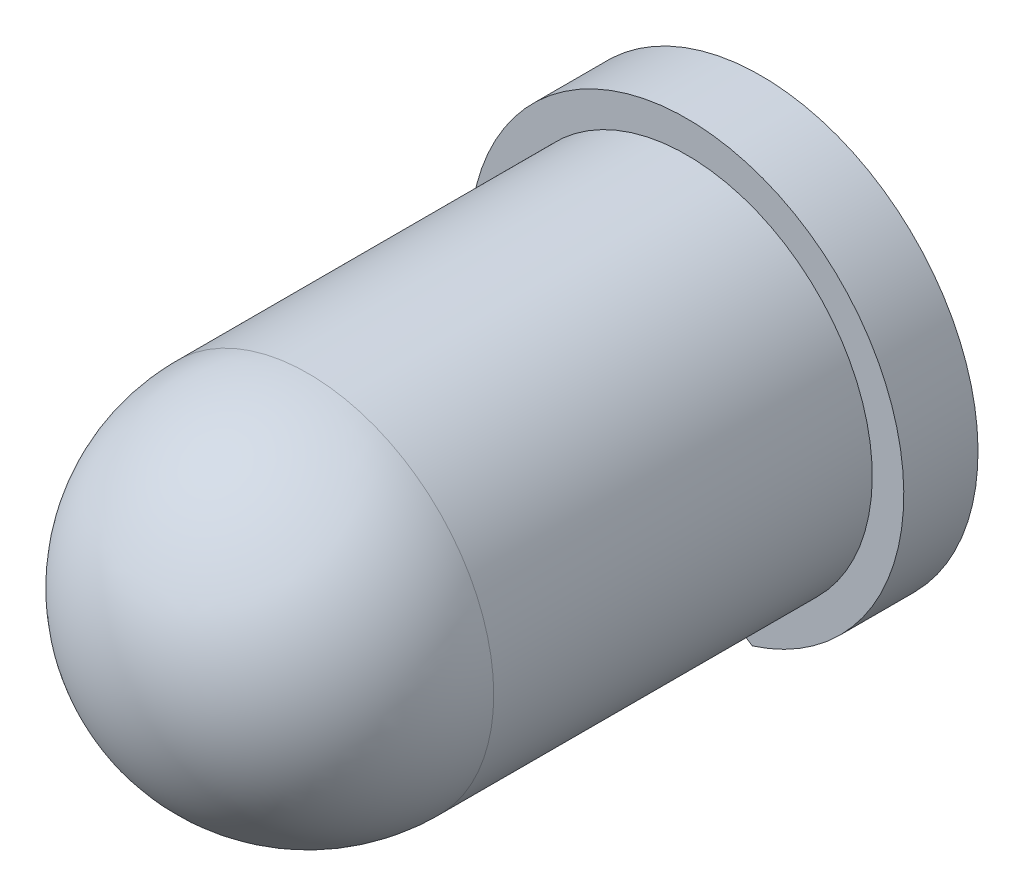
from build123d import *

# Parameters (mm, degrees)
SKETCH1_R                = 2.5
SKETCH1_R_2              = 2
BOSS_EXTRUDE1_DEPTH      = 5.1
SKETCH3_R                = 2.925
BOSS_EXTRUDE2_DEPTH      = 1
SKETCH4_R                = 2
CUT_EXTRUDE2_DEPTH       = 5.1
BOSS_EXTRUDE3_DEPTH      = 0.3
BOSS_EXTRUDE3_DEPTH_BACK = 0.3
SKETCH9_R                = 1.5
CUT_EXTRUDE3_DEPTH       = 3


with BuildPart() as part:
    # Sketch1 → Boss-Extrude1 (new body)
    with BuildSketch(Plane.XY):
        Circle(SKETCH1_R)
        Circle(SKETCH1_R_2, mode=Mode.SUBTRACT)
    extrude(amount=BOSS_EXTRUDE1_DEPTH)

    # Sketch2 → Revolve1 (revolve)
    with BuildSketch(Plane.XY.offset(5.1)):
        with BuildLine():
            Line((-2.5, 0), (-2, 0))
            ThreePointArc((-2, 0), (0, -2), (2, 0))
            Line((2, 0), (2.5, 0))
            ThreePointArc((2.5, 0), (0, -2.5), (-2.5, 0))
        make_face()
    revolve(axis=Axis((-3.079262147, 0, 5.1), (1, 0, 0)))

    # Sketch3 → Boss-Extrude2 (add)
    with BuildSketch(Plane(origin=(0, 0, 0), x_dir=(-1, 0, 0), z_dir=(0, 0, -1))):
        Circle(SKETCH3_R)
    extrude(amount=BOSS_EXTRUDE2_DEPTH)

    # Sketch4 → Cut-Extrude2 (cut)
    with BuildSketch(Plane.XY):
        Circle(SKETCH4_R)
    extrude(amount=CUT_EXTRUDE2_DEPTH, mode=Mode.SUBTRACT)

    # Sketch6 → Boss-Extrude3 (add, two sides: drawn at the far end of the back side and taken through both)
    with BuildSketch(Plane(origin=(0, 0, 0), x_dir=(0, 0, -1), z_dir=(1, 0, 0)).offset(-BOSS_EXTRUDE3_DEPTH_BACK)):
        Polygon((0, 1.206894491), (-3.556166294, 1.206894491), (-3.556166294, -0.084621026), (-2.37503672, 0.643926189), (-2.37503672, 0.897813854), (0, 0.897813854), align=None)
        Polygon((-3.556166294, -0.28331572), (-3.330966178, -0.28331572), (-3.330966178, -0.18084552), (-2.37503672, 0.4341929), (-2.37503672, -0.28331572), (0, -0.28331572), (0, -0.780052457), (-3.556166294, -0.780052457), align=None)
    extrude(amount=BOSS_EXTRUDE3_DEPTH + BOSS_EXTRUDE3_DEPTH_BACK)

    # Sketch9 → Cut-Extrude3 (cut)
    with BuildSketch(Plane.XY):
        with Locations((0, -4)):
            Circle(SKETCH9_R)
    extrude(amount=-CUT_EXTRUDE3_DEPTH, mode=Mode.SUBTRACT)


solid = part.part
